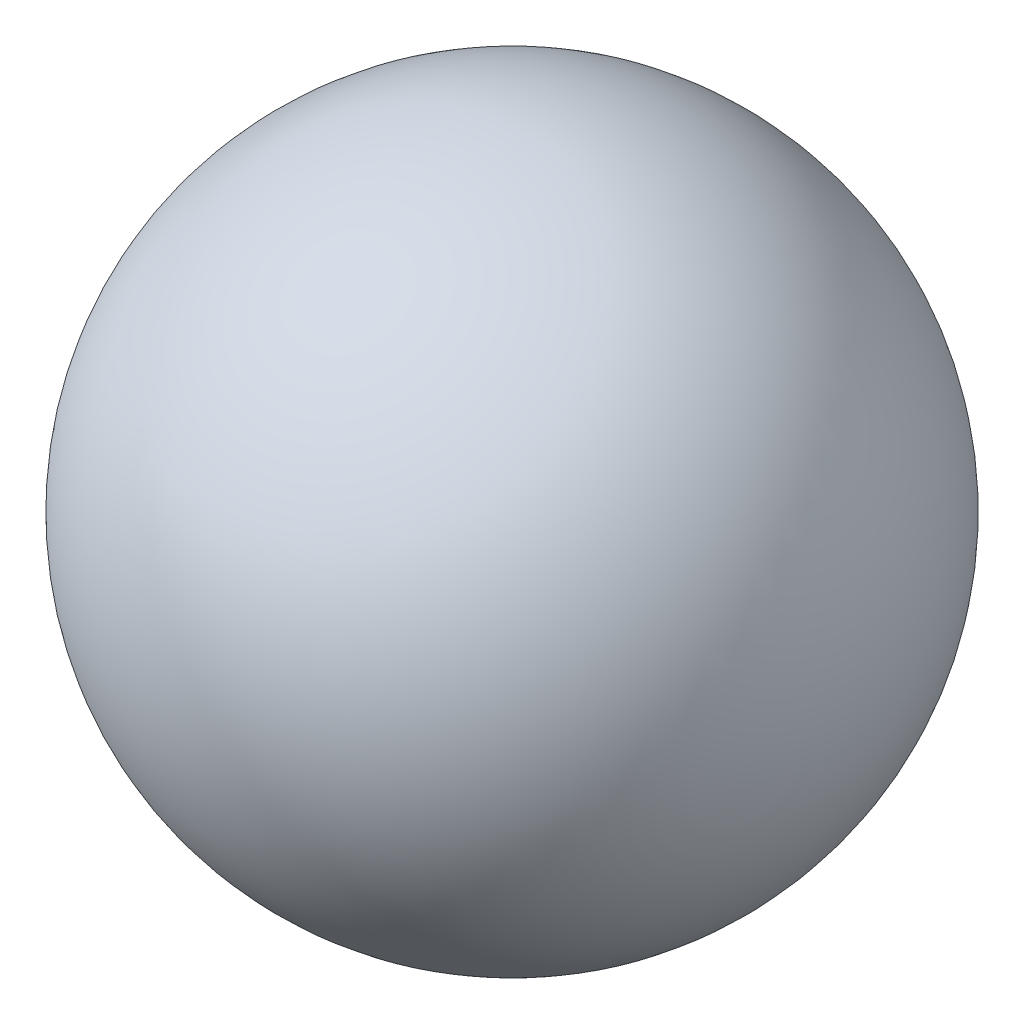
from build123d import *
from build123d.topology import SkipClean


with BuildPart() as part:
    # 스케치1 → 회전3 (revolve)
    with SkipClean():  # the faces are left unmerged after this step: merging them gives an invalid solid
        with BuildSketch(Plane.XY):
            with BuildLine():
                ThreePointArc((3.86, 0), (2.729432175, 2.729432175), (0, 3.86))
                Line((0, 3.86), (0, -3.86))
                ThreePointArc((0, -3.86), (2.729432175, -2.729432175), (3.86, 0))
            make_face()
            with BuildLine():
                Line((0, -3.86), (0, 3.86))
                ThreePointArc((0, 3.86), (-3.86, 0), (0, -3.86))
            make_face()
        revolve(axis=Axis((0, 3.86, 0), (0, -1, 0)))


solid = part.part
